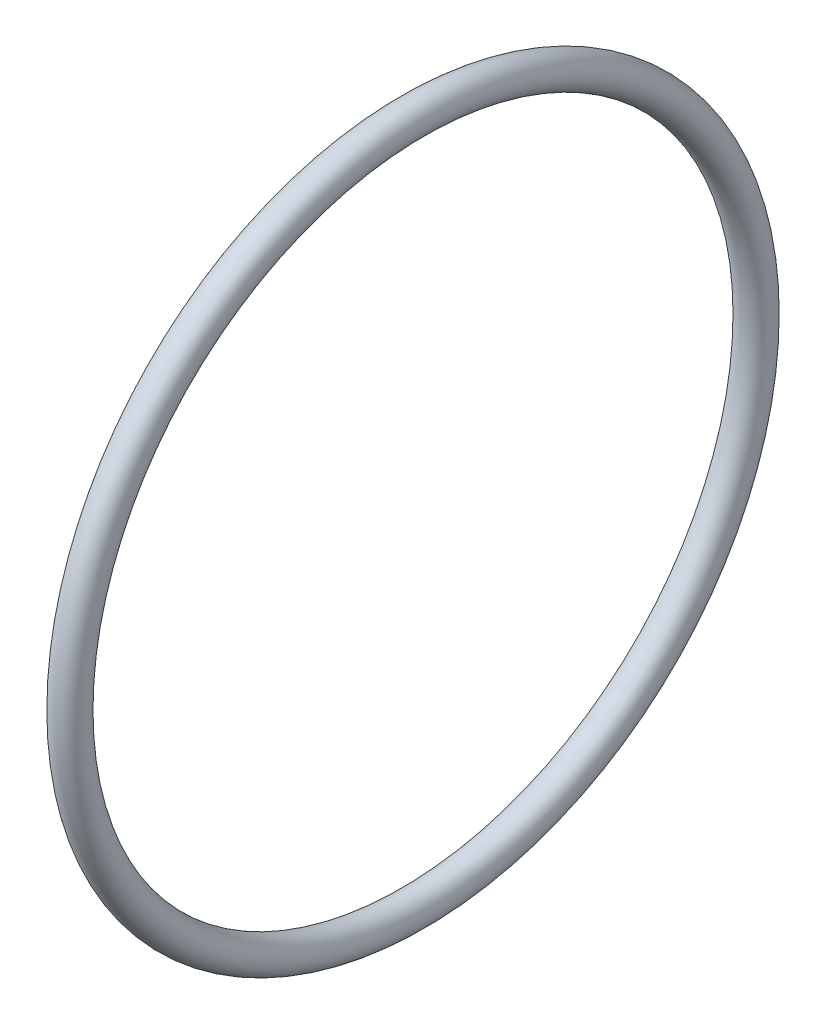
from build123d import *

# Parameters (mm, degrees)
SKETCH1_R = 0.75


with BuildPart() as part:
    # Sketch1 → Revolve1 (revolve)
    with BuildSketch(Plane.XY, mode=Mode.PRIVATE) as revolve1_sk:
        Circle(SKETCH1_R)
    revolve(revolve1_sk.sketch.rotate(Axis((-2.665122588, -15.75, 0), (1, 0, 0)), 90), axis=Axis((-2.665122588, -15.75, 0), (1, 0, 0)))


solid = part.part
